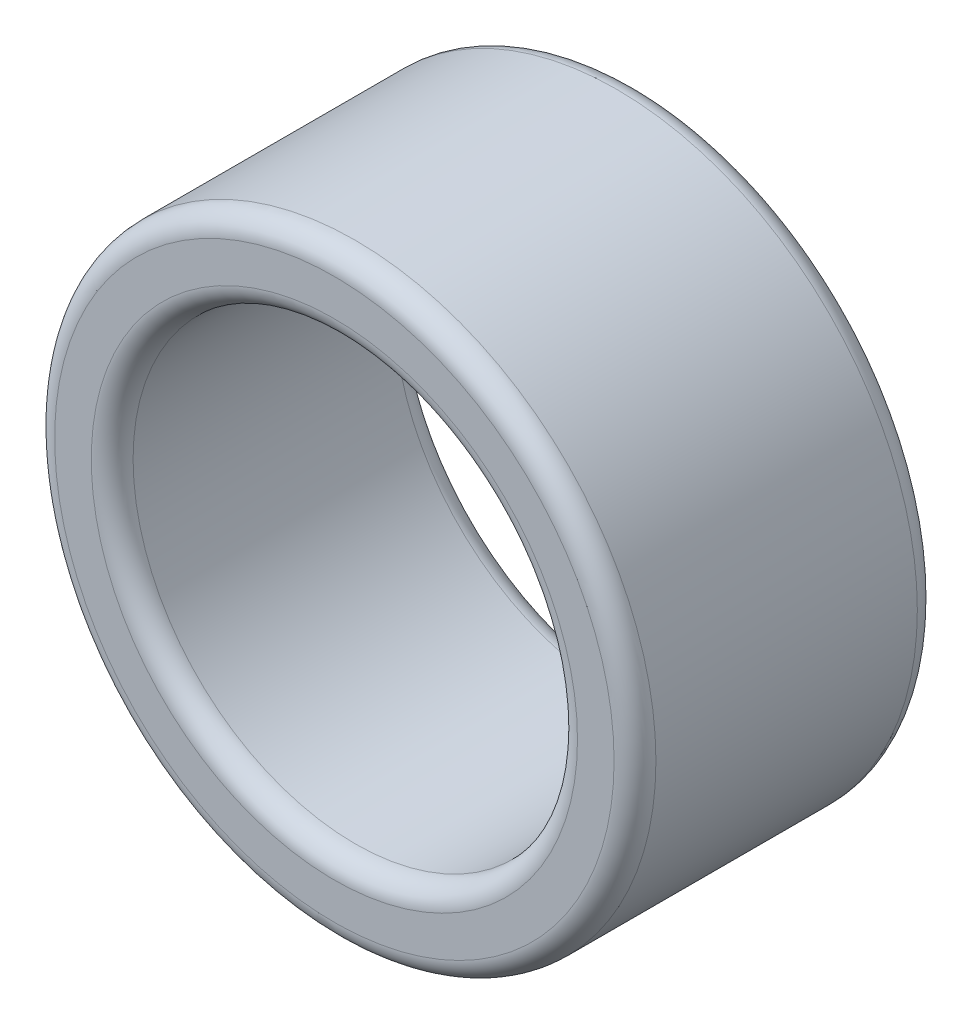
from build123d import *

# Parameters (mm, degrees)
SKETCH_1_R        = 57.5
SKETCH_1_R_2      = 42.5
EXTRUDE_317_DEPTH = 29
FILLET_1_R        = 4


with BuildPart() as part:
    # Эскиз1 → Extrude 317 (new, symmetric)
    with BuildSketch(Plane.XY):
        with Locations(Location((0, 0, 0), (0, 0, 180))):
            Circle(SKETCH_1_R)
        with Locations(Location((0, 0, 0), (0, 0, 180))):
            Circle(SKETCH_1_R_2, mode=Mode.SUBTRACT)
    extrude(amount=EXTRUDE_317_DEPTH, both=True)

    # Скругление1
    fillet_1_edges = [part.edges().sort_by_distance(p)[0] for p in [
        (57.5, 0, -29),
        (57.5, 0, 29),
        (42.5, 0, -29),
        (42.5, 0, 29),
    ]]
    fillet(fillet_1_edges, radius=FILLET_1_R)


solid = part.part
